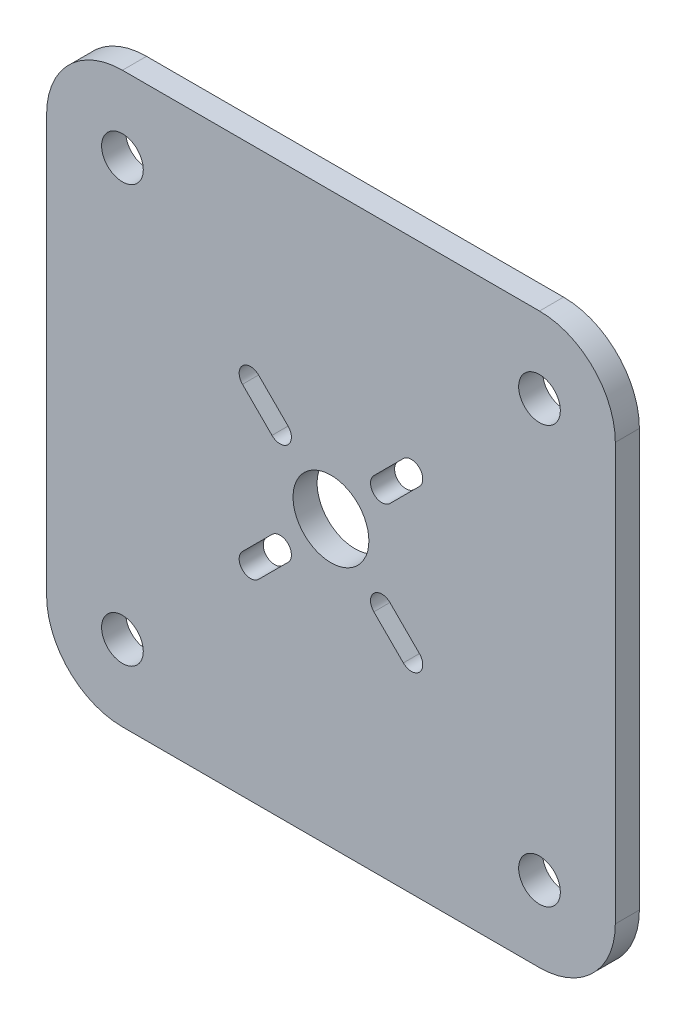
from build123d import *

# Parameters (mm, degrees)
SKETCH1_W               = 75
SKETCH1_H               = 75
SKETCH1_R               = 2.75
SKETCH1_R_2             = 5
BOSS_EXTRUDE1_DEPTH     = 3.175
CUT_EXTRUDE1_DEPTH      = 320.126840966
CUT_EXTRUDE1_DEPTH_BACK = 320.126840966
FILLET1_R               = 10


with BuildPart() as part:
    # Sketch1 → Boss-Extrude1 (new body)
    with BuildSketch(Plane.XY.offset(151.125)):
        with Locations((0, 279.4)):
            Rectangle(SKETCH1_W, SKETCH1_H)
        with Locations((-27.5, 251.9)):
            Circle(SKETCH1_R, mode=Mode.SUBTRACT)
        with Locations((27.5, 251.9)):
            Circle(SKETCH1_R, mode=Mode.SUBTRACT)
        with Locations((27.5, 306.9)):
            Circle(SKETCH1_R, mode=Mode.SUBTRACT)
        with Locations((-27.5, 306.9)):
            Circle(SKETCH1_R, mode=Mode.SUBTRACT)
        with Locations((0, 279.4)):
            Circle(SKETCH1_R_2, mode=Mode.SUBTRACT)
    extrude(amount=BOSS_EXTRUDE1_DEPTH)

    # Sketch2 → Cut-Extrude1 (cut, two sides: drawn at the far end of the back side and taken through both)
    with BuildSketch(Plane.XY.offset(154.3).offset(-CUT_EXTRUDE1_DEPTH_BACK)):
        with BuildLine():
            Line((5.656854249, 287.178174593), (9.545941546, 291.06726189))
            ThreePointArc((9.545941546, 291.06726189), (11.66726189, 291.06726189), (11.66726189, 288.945941546))
            Line((11.66726189, 288.945941546), (7.778174593, 285.056854249))
            ThreePointArc((7.778174593, 285.056854249), (5.656854249, 285.056854249), (5.656854249, 287.178174593))
        make_face()
        with BuildLine():
            Line((7.778174593, 273.743145751), (11.66726189, 269.854058454))
            ThreePointArc((11.66726189, 269.854058454), (11.66726189, 267.73273811), (9.545941546, 267.73273811))
            Line((9.545941546, 267.73273811), (5.656854249, 271.621825407))
            ThreePointArc((5.656854249, 271.621825407), (5.656854249, 273.743145751), (7.778174593, 273.743145751))
        make_face()
        with BuildLine():
            Line((-5.656854249, 271.621825407), (-9.545941546, 267.73273811))
            ThreePointArc((-9.545941546, 267.73273811), (-11.66726189, 267.73273811), (-11.66726189, 269.854058454))
            Line((-11.66726189, 269.854058454), (-7.778174593, 273.743145751))
            ThreePointArc((-7.778174593, 273.743145751), (-5.656854249, 273.743145751), (-5.656854249, 271.621825407))
        make_face()
        with BuildLine():
            Line((-7.778174593, 285.056854249), (-11.66726189, 288.945941546))
            ThreePointArc((-11.66726189, 288.945941546), (-11.66726189, 291.06726189), (-9.545941546, 291.06726189))
            Line((-9.545941546, 291.06726189), (-5.656854249, 287.178174593))
            ThreePointArc((-5.656854249, 287.178174593), (-5.656854249, 285.056854249), (-7.778174593, 285.056854249))
        make_face()
    extrude(amount=CUT_EXTRUDE1_DEPTH + CUT_EXTRUDE1_DEPTH_BACK, mode=Mode.SUBTRACT)

    # Fillet1
    fillet1_edges = [part.edges().sort_by_distance(p)[0] for p in [
        (37.5, 241.9, 152.7125),
        (-37.5, 241.9, 152.7125),
        (-37.5, 316.9, 152.7125),
        (37.5, 316.9, 152.7125),
    ]]
    fillet(fillet1_edges, radius=FILLET1_R)


solid = part.part
